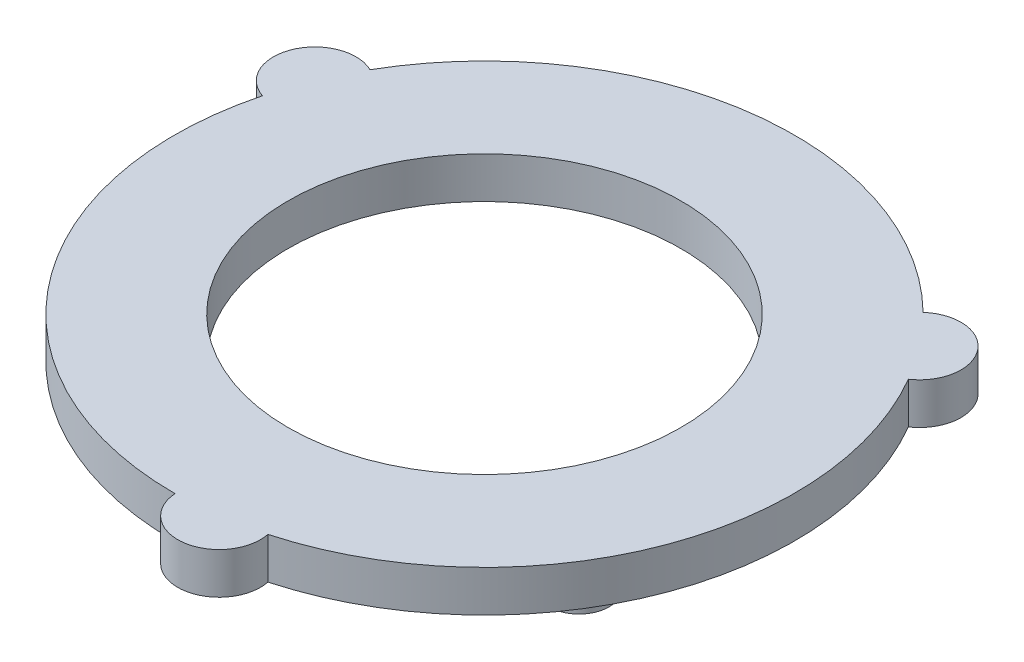
from build123d import *

# Parameters (mm, degrees)
SKETCH1_R                = 19
BOSS_EXTRUDE1_DEPTH      = 3.5
SKETCH2_R                = 30
SKETCH2_R_2              = 19
SKETCH2_R_3              = 2.8
BOSS_EXTRUDE2_DEPTH      = 4
CUT_EXTRUDE1_START       = -10
SKETCH3_R                = 19
CUT_EXTRUDE1_DEPTH       = 10
BOSS_EXTRUDE3_DEPTH      = 2
BOSS_EXTRUDE3_DEPTH_BACK = 4
SKETCH4_R                = 2.9
SKETCH5_R                = 4
BOSS_EXTRUDE4_DEPTH      = 4


with BuildPart() as part:
    # Sketch1 → Boss-Extrude1 (new body)
    with BuildSketch(Plane(origin=(0, 0, 0), x_dir=(1, 0, 0), z_dir=(0, 1, 0))):
        with Locations(Location((0, 0, 0), (0, 0, 270))):
            Circle(SKETCH1_R)
    extrude(amount=BOSS_EXTRUDE1_DEPTH)

    # Sketch2 → Boss-Extrude2 (add)
    with BuildSketch(Plane(origin=(0, 0, 0), x_dir=(1, 0, 0), z_dir=(0, 1, 0))):
        with Locations(Location((0, 0, 0), (0, 0, 270))):
            Circle(SKETCH2_R)
        with Locations(Location((0, 0, 0), (0, 0, 270))):
            Circle(SKETCH2_R_2, mode=Mode.SUBTRACT)
        with Locations(Location((0, 25, 0), (0, 0, 270))):
            Circle(SKETCH2_R_3, mode=Mode.SUBTRACT)
        with Locations(Location((21.650635095, -12.5, 0), (0, 0, 270))):
            Circle(SKETCH2_R_3, mode=Mode.SUBTRACT)
        with Locations(Location((-21.650635095, -12.5, 0), (0, 0, 270))):
            Circle(SKETCH2_R_3, mode=Mode.SUBTRACT)
    extrude(amount=BOSS_EXTRUDE2_DEPTH)

    # Sketch3 → Cut-Extrude1 (cut)
    with BuildSketch(Plane(origin=(0, 3.5, 0), x_dir=(1, 0, 0), z_dir=(0, 1, 0)).offset(CUT_EXTRUDE1_START)):
        with Locations(Location((0, 0, 0), (0, 0, 270))):
            Circle(SKETCH3_R)
    extrude(amount=CUT_EXTRUDE1_DEPTH, mode=Mode.SUBTRACT)

    # Sketch4 → Boss-Extrude3 (add, two sides: drawn at the far end of the back side and taken through both)
    with BuildSketch(Plane.XZ.offset(-BOSS_EXTRUDE3_DEPTH_BACK)):
        with Locations(Location((-21.650635095, 12.5, 0), (0, 0, 270))):
            Circle(SKETCH4_R)
        with Locations(Location((21.650635095, 12.5, 0), (0, 0, 270))):
            Circle(SKETCH4_R)
        with Locations(Location((0, -25, 0), (0, 0, 270))):
            Circle(SKETCH4_R)
    extrude(amount=BOSS_EXTRUDE3_DEPTH + BOSS_EXTRUDE3_DEPTH_BACK)

    # Sketch5 → Boss-Extrude4 (add)
    with BuildSketch(Plane(origin=(0, 4, 0), x_dir=(1, 0, 0), z_dir=(0, 1, 0))):
        with Locations((-27.769349467, 11.35179414)):
            Circle(SKETCH5_R)
        with Locations((23.715616837, 18.373065015)):
            Circle(SKETCH5_R)
        with Locations((4.05373263, -29.724859155)):
            Circle(SKETCH5_R)
    extrude(amount=-BOSS_EXTRUDE4_DEPTH)


solid = part.part
